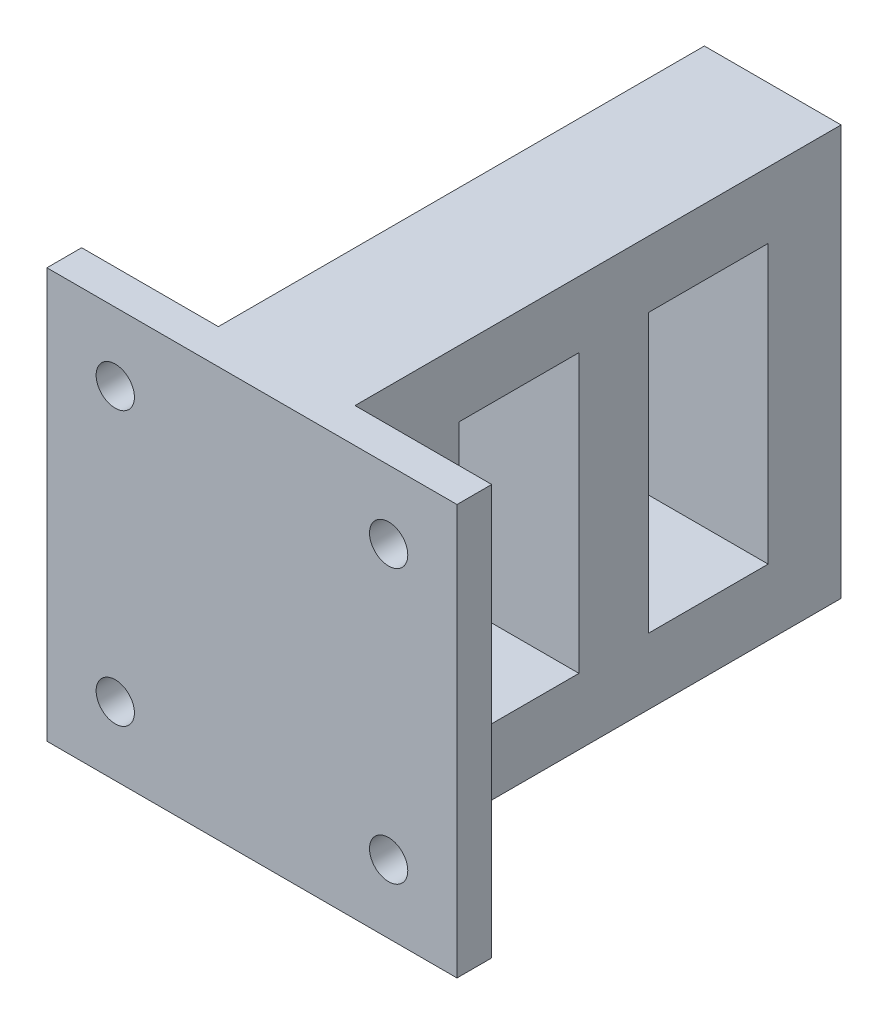
from build123d import *

# Parameters (mm, degrees)
SKETCH2_W           = 30
SKETCH2_H           = 30
SKETCH2_R           = 1.4
BOSS_EXTRUDE1_DEPTH = 2.54
SKETCH3_W           = 10
SKETCH3_H           = 30
BOSS_EXTRUDE2_DEPTH = 35.56
SKETCH4_W           = 8.763
SKETCH4_H           = 20.32
CUT_EXTRUDE1_DEPTH  = 35.56


with BuildPart() as part:
    # Sketch2 → Boss-Extrude1 (new body)
    with BuildSketch(Plane.XY):
        with Locations((15, 15)):
            Rectangle(SKETCH2_W, SKETCH2_H)
        with Locations((5, 5)):
            Circle(SKETCH2_R, mode=Mode.SUBTRACT)
        with Locations((25, 5)):
            Circle(SKETCH2_R, mode=Mode.SUBTRACT)
        with Locations((5, 25)):
            Circle(SKETCH2_R, mode=Mode.SUBTRACT)
        with Locations((25, 25)):
            Circle(SKETCH2_R, mode=Mode.SUBTRACT)
    extrude(amount=BOSS_EXTRUDE1_DEPTH)

    # Sketch3 → Boss-Extrude2 (add)
    with BuildSketch(Plane(origin=(0, 0, 0), x_dir=(-1, 0, 0), z_dir=(0, 0, -1))):
        with Locations((-15, 15)):
            Rectangle(SKETCH3_W, SKETCH3_H)
    extrude(amount=BOSS_EXTRUDE2_DEPTH)

    # Sketch4 → Cut-Extrude1 (cut)
    with BuildSketch(Plane.ZY.offset(-10)):
        with Locations((-25.8445, 15)):
            Rectangle(SKETCH4_W, SKETCH4_H)
        with Locations((-12.0015, 15)):
            Rectangle(SKETCH4_W, SKETCH4_H)
    extrude(amount=-CUT_EXTRUDE1_DEPTH, mode=Mode.SUBTRACT)


solid = part.part
